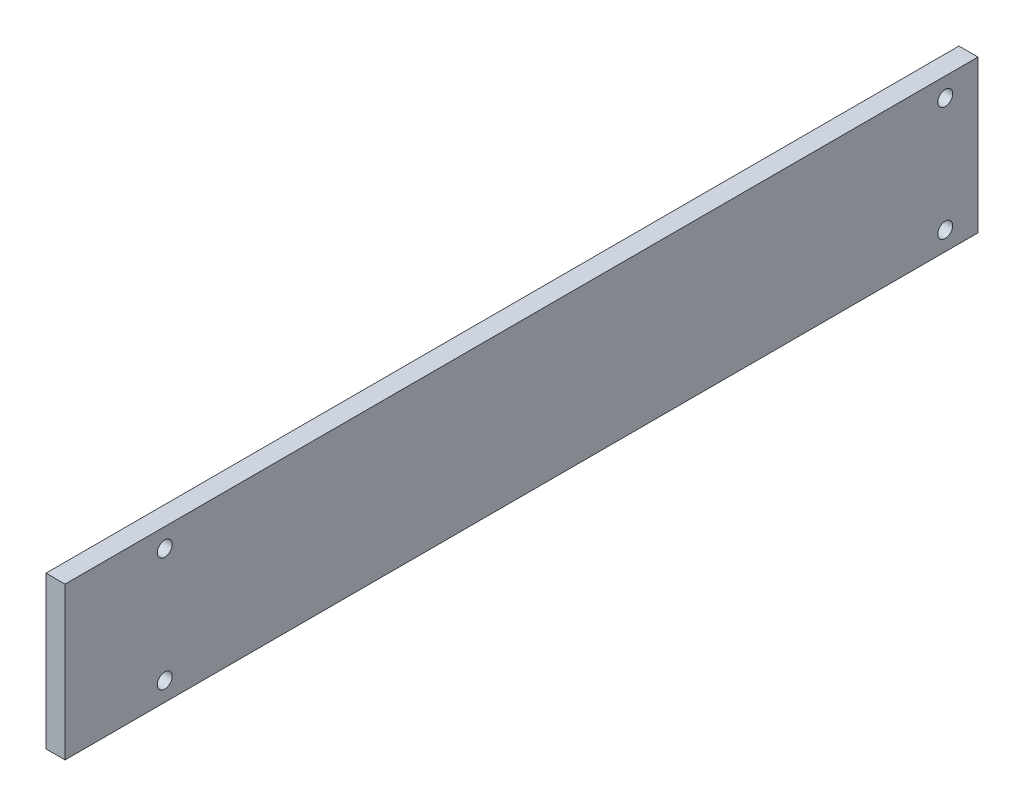
from build123d import *

# Parameters (mm, degrees)
SKETCH1_W              = 304.546
SKETCH1_H              = 50.8
BOSS_EXTRUDE1_DEPTH    = 6.35
F_10_CLEARANCE_HOLE1_D = 4.9784


with BuildPart() as part:
    # Sketch1 → Boss-Extrude1 (new body)
    with BuildSketch(Plane(origin=(0, 0, 0), x_dir=(0, 0, -1), z_dir=(1, 0, 0))):
        Rectangle(SKETCH1_W, SKETCH1_H)
    extrude(amount=BOSS_EXTRUDE1_DEPTH)

    # #10 Clearance Hole1 (through all)
    with Locations(Plane(origin=(6.35, 0, 0), x_dir=(0, 0, -1), z_dir=(1, 0, 0))):
        with Locations((-118.999, 19.05), (-118.999, -19.05), (141.351, -19.05), (141.351, 19.05)):
            Hole(F_10_CLEARANCE_HOLE1_D / 2)


solid = part.part
